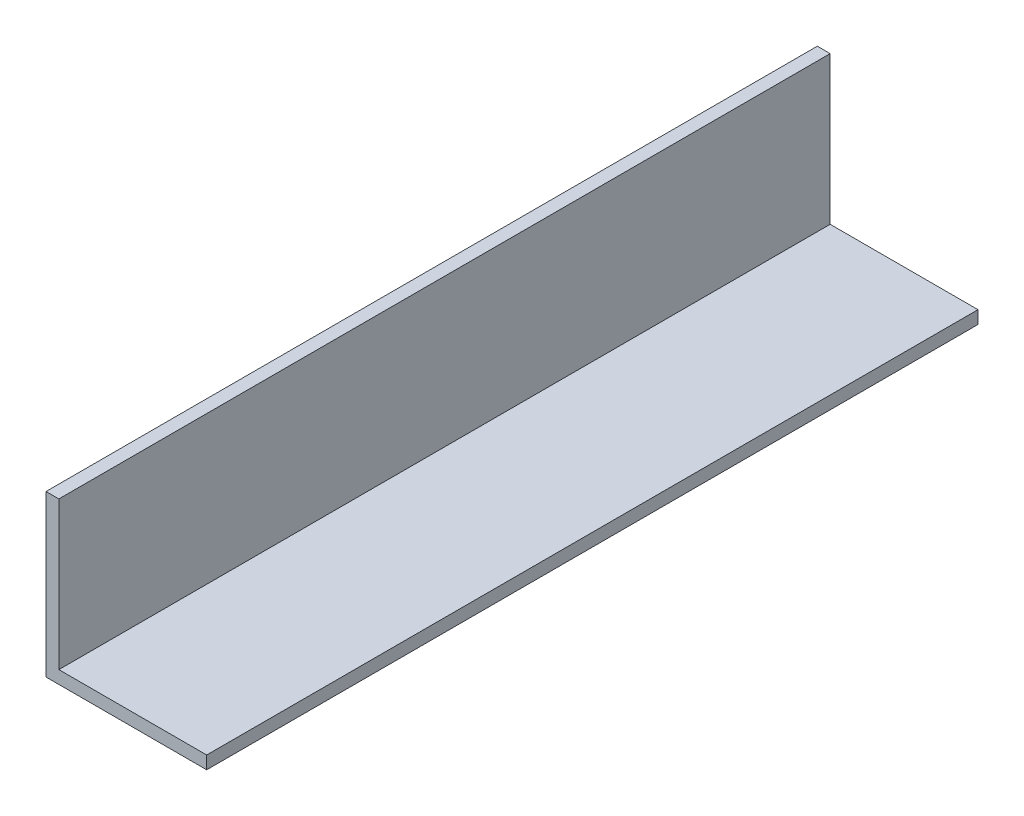
from build123d import *

# Parameters (mm, degrees)
BOSS_EXTRUDE1_DEPTH = 120


with BuildPart() as part:
    # Sketch1 → Boss-Extrude1 (new body)
    with BuildSketch(Plane.XY):
        Polygon((0, 0), (25, 0), (25, 2), (2, 2), (2, 25), (0, 25), align=None)
    extrude(amount=BOSS_EXTRUDE1_DEPTH)


solid = part.part
